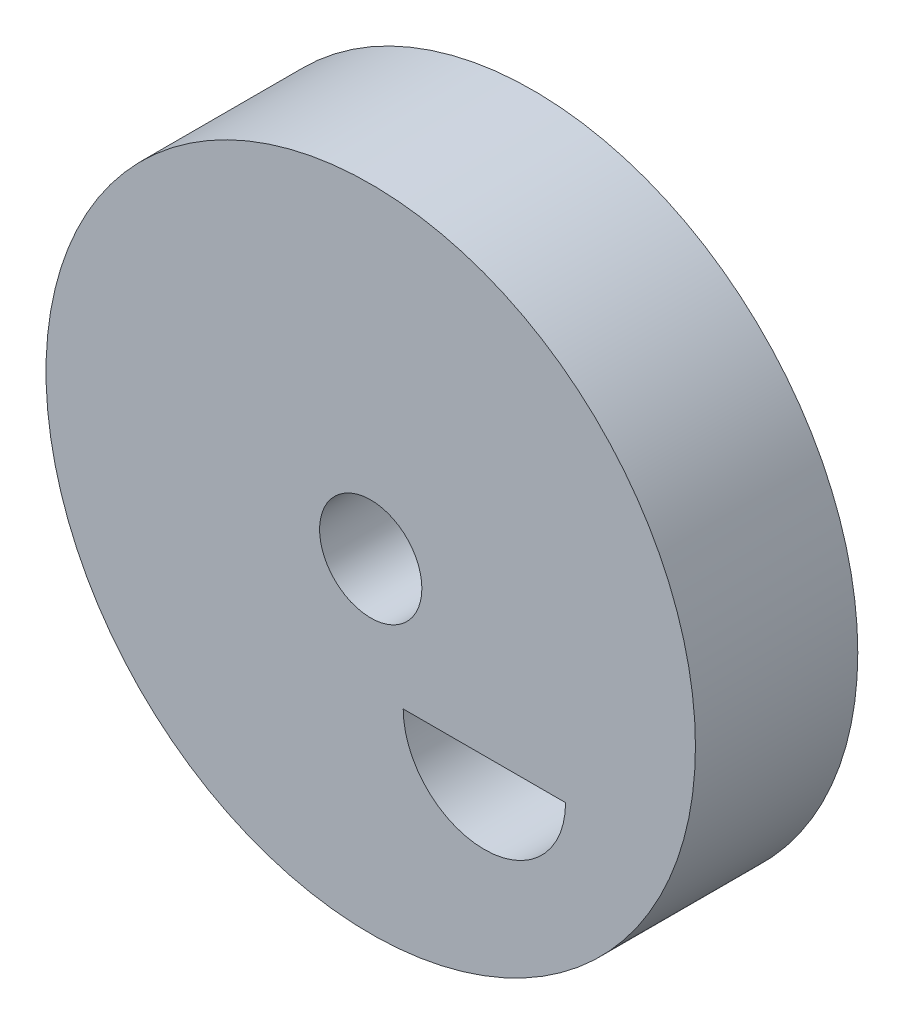
from build123d import *

# Parameters (mm, degrees)
SKETCH1_R           = 25.4
SKETCH1_R_2         = 4.0000047
BOSS_EXTRUDE1_DEPTH = 12.7
SKETCH2_R           = 6.35
CUT_EXTRUDE1_DEPTH  = 6.35
CUT_EXTRUDE2_DEPTH  = 12.7


with BuildPart() as part:
    # Sketch1 → Boss-Extrude1 (new body)
    with BuildSketch(Plane.XY):
        Circle(SKETCH1_R)
        Circle(SKETCH1_R_2, mode=Mode.SUBTRACT)
    extrude(amount=BOSS_EXTRUDE1_DEPTH)

    # Sketch2 → Cut-Extrude1 (cut)
    with BuildSketch(Plane.XY):
        with Locations((8.89, -8.89)):
            Circle(SKETCH2_R)
    extrude(amount=CUT_EXTRUDE1_DEPTH, mode=Mode.SUBTRACT)

    # Sketch3 → Cut-Extrude2 (cut)
    with BuildSketch(Plane.XY):
        with BuildLine():
            Line((2.54, -8.89), (15.24, -8.89))
            ThreePointArc((15.24, -8.89), (8.89, -15.24), (2.54, -8.89))
        make_face()
    extrude(amount=CUT_EXTRUDE2_DEPTH, mode=Mode.SUBTRACT)


solid = part.part
